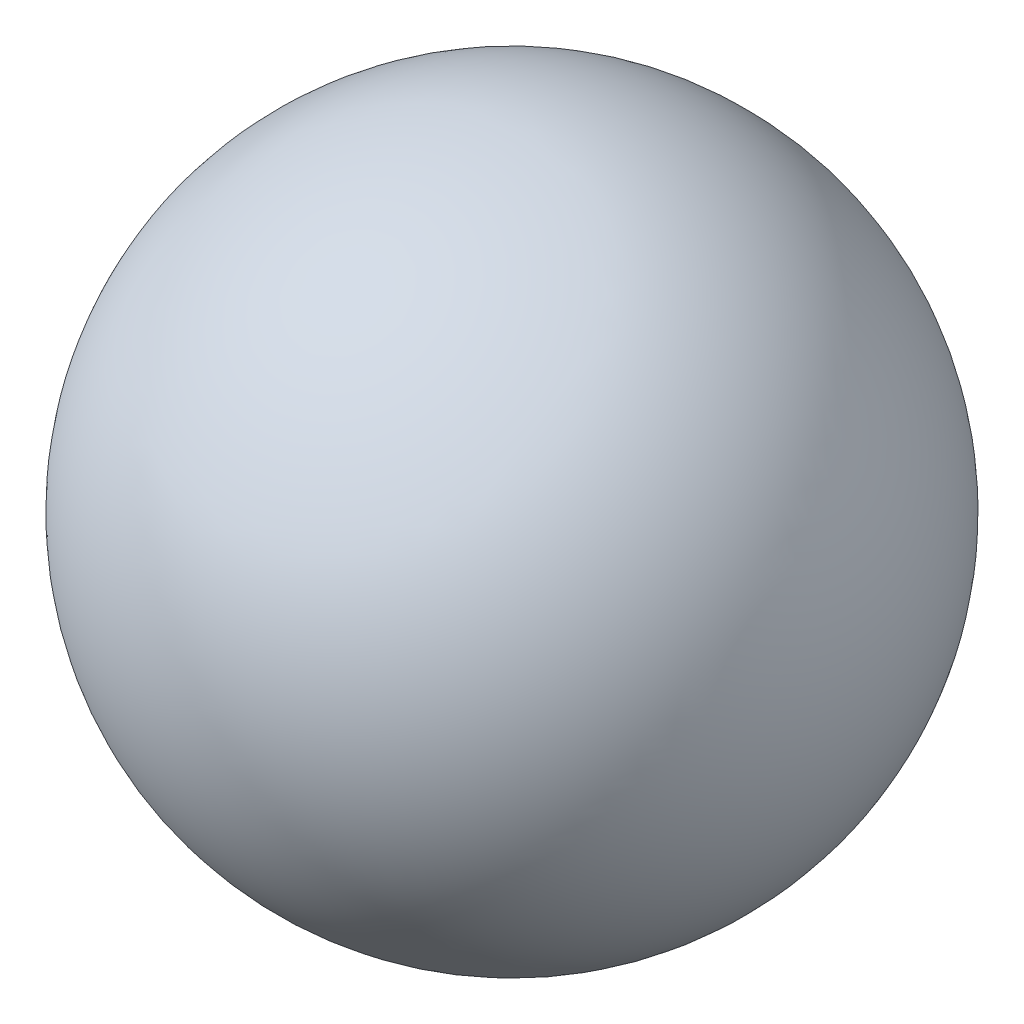
from build123d import *

# Parameters (mm, degrees)
SCALE1_SCALE = 0.277777778


with BuildPart() as part:
    # Sketch2 → Revolve1 (revolve)
    with BuildSketch(Plane.XY):
        with BuildLine():
            Line((-45, 0), (45, 0))
            ThreePointArc((45, 0), (0, -45), (-45, 0))
        make_face()
    revolve(axis=Axis((-45, 0, 0), (1, 0, 0)))


with BuildPart() as part_1:
    # Scale1: scaled about (0, 0, 0)
    add(part.part.scale(SCALE1_SCALE))


solid = part_1.part
